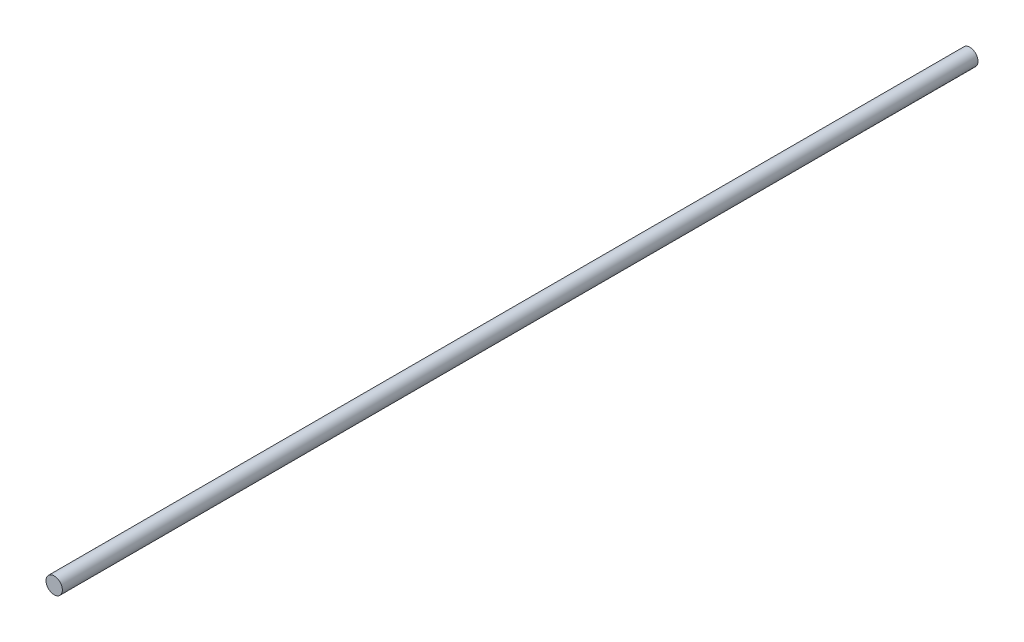
from build123d import *

# Parameters (mm, degrees)
SKETCH1_R           = 2.5
BOSS_EXTRUDE1_DEPTH = 280


with BuildPart() as part:
    # Sketch1 → Boss-Extrude1 (new body)
    with BuildSketch(Plane.XY):
        Circle(SKETCH1_R)
    extrude(amount=BOSS_EXTRUDE1_DEPTH)


solid = part.part
